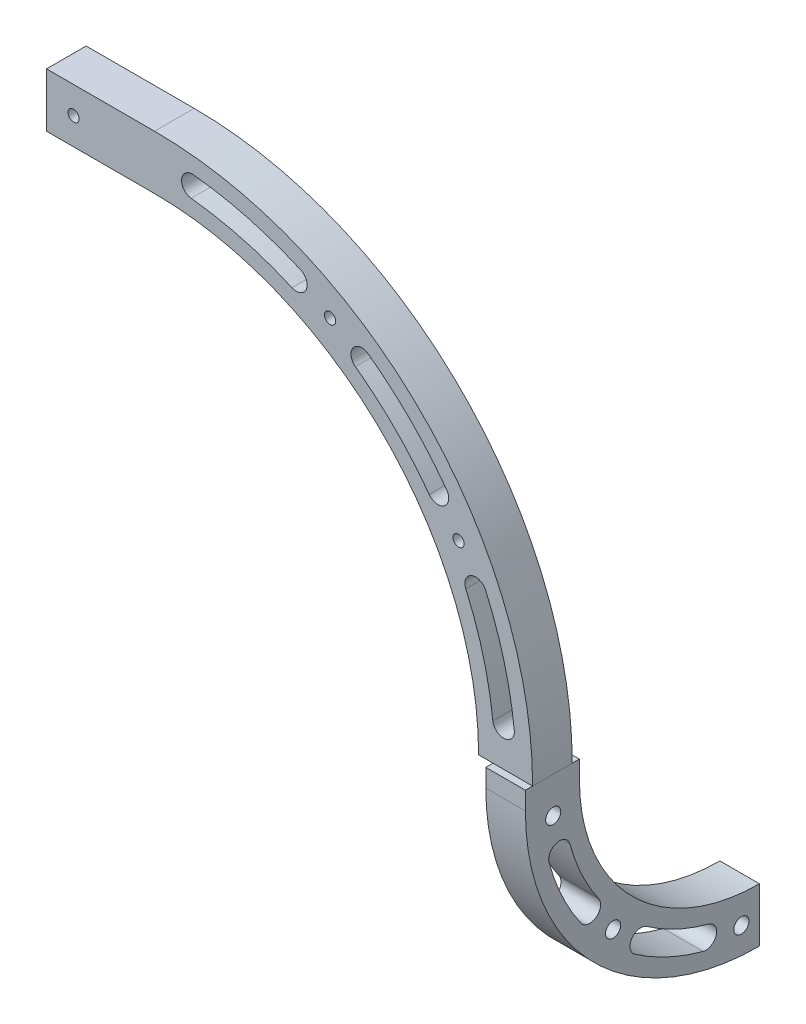
from build123d import *

# Parameters (mm, degrees)
EXTRUDE_1_DEPTH     = 15
SKETCH_2_W          = 15
SKETCH_2_H          = 15
EXTRUDE_2_DEPTH     = 5
EXTRUDE_3_DEPTH     = 15
SKETCH_4_R          = 1.55
CUT_EXTRUDE_1_DEPTH = 163.095650774
SKETCH_5_R          = 1.55
CUT_EXTRUDE_2_DEPTH = 157.68439616
CUT_EXTRUDE_START   = -2
CUT_EXTRUDE_4_DEPTH = 2
CUT_EXTRUDE_START_2 = -4
CUT_EXTRUDE_5_DEPTH = 4
CUT_EXTRUDE_6_DEPTH = 2
SKETCH_9_W          = 11
SKETCH_9_H          = 15
EXTRUDE_4_DEPTH     = 30
SKETCH_11_W         = 15
SKETCH_11_H         = 5
CUT_EXTRUDE_7_DEPTH = 4
SKETCH_12_R         = 2.1
CUT_EXTRUDE_8_DEPTH = 4.5
SKETCH_13_R         = 1.55
CUT_EXTRUDE_9_DEPTH = 162.304060705


with BuildPart() as part:
    # 草图1 → 凸台-拉伸1 (new body)
    with BuildSketch(Plane.XY):
        with BuildLine():
            Line((90, 0), (105, 0))
            ThreePointArc((105, 0), (74.246212025, 74.246212025), (0, 105))
            Line((0, 105), (0, 90))
            ThreePointArc((0, 90), (63.639610307, 63.639610307), (90, 0))
        make_face()
    extrude(amount=EXTRUDE_1_DEPTH)

    # 草图2 → 凸台-拉伸2 (add)
    with BuildSketch(Plane.XZ):
        with Locations((97.5, 7.5)):
            Rectangle(SKETCH_2_W, SKETCH_2_H)
    extrude(amount=EXTRUDE_2_DEPTH)

    # 草图3 → 凸台-拉伸3 (add)
    with BuildSketch(Plane(origin=(105, 0, 0), x_dir=(0, 0, -1), z_dir=(1, 0, 0))):
        with BuildLine():
            Line((50, -55), (50, -70))
            ThreePointArc((50, -70), (4.038059223, -50.961940777), (-15, -5))
            Line((-15, -5), (0, -5))
            ThreePointArc((0, -5), (14.644660941, -40.355339059), (50, -55))
        make_face()
    extrude(amount=-EXTRUDE_3_DEPTH)

    # 草图4 → 切除-拉伸1 (cut, through all)
    with BuildSketch(Plane.XY.offset(15)):
        with Locations((84.437476869, 48.75)):
            Circle(SKETCH_4_R)
        with Locations((48.75, 84.437476869)):
            Circle(SKETCH_4_R)
        with BuildLine():
            ThreePointArc((40.593936087, 91.936838933), (26.011314033, 97.075545542), (10.813039575, 99.916606103))
            ThreePointArc((10.813039575, 99.916606103), (7.507677018, 97.256798147), (10.167484974, 93.951435589))
            ThreePointArc((10.167484974, 93.951435589), (24.458399762, 91.279990584), (38.170417515, 86.448072429))
            ThreePointArc((38.170417515, 86.448072429), (42.126560053, 87.980696395), (40.593936087, 91.936838933))
        make_face()
        with BuildLine():
            ThreePointArc((81.123799357, 59.322670016), (71.064231509, 71.064231509), (59.322670016, 81.123799357))
            ThreePointArc((59.322670016, 81.123799357), (55.130238094, 80.473019377), (55.781018075, 76.280587456))
            ThreePointArc((55.781018075, 76.280587456), (66.821590822, 66.821590822), (76.280587456, 55.781018075))
            ThreePointArc((76.280587456, 55.781018075), (80.473019377, 55.130238094), (81.123799357, 59.322670016))
        make_face()
        with BuildLine():
            ThreePointArc((99.916606103, 10.813039575), (97.075545542, 26.011314033), (91.936838933, 40.593936087))
            ThreePointArc((91.936838933, 40.593936087), (87.980696395, 42.126560053), (86.448072429, 38.170417515))
            ThreePointArc((86.448072429, 38.170417515), (91.279990584, 24.458399762), (93.951435589, 10.167484974))
            ThreePointArc((93.951435589, 10.167484974), (97.256798147, 7.507677018), (99.916606103, 10.813039575))
        make_face()
    extrude(amount=-CUT_EXTRUDE_1_DEPTH, mode=Mode.SUBTRACT)

    # 草图5 → 切除-拉伸2 (cut, through all)
    with BuildSketch(Plane(origin=(105, 0, 0), x_dir=(0, 0, -1), z_dir=(1, 0, 0))):
        with Locations((44.969401847, -62.5)):
            Circle(SKETCH_5_R)
        with Locations((9.341360082, -45.658639918)):
            Circle(SKETCH_5_R)
        with Locations((-7.28119514, -10.011455208)):
            Circle(SKETCH_5_R)
        with BuildLine():
            ThreePointArc((-8.432245014, -20.681924073), (-4.831621116, -30.568404835), (0.427426106, -39.681550102))
            ThreePointArc((0.427426106, -39.681550102), (4.605316552, -40.419947976), (5.343714426, -36.24205753))
            ThreePointArc((5.343714426, -36.24205753), (0.606225607, -28.032695265), (-2.637311624, -19.126691933))
            ThreePointArc((-2.637311624, -19.126691933), (-6.312394389, -17.006841308), (-8.432245014, -20.681924073))
        make_face()
        with BuildLine():
            ThreePointArc((15.318449898, -54.572573894), (24.431595165, -59.831621116), (34.318075927, -63.432245014))
            ThreePointArc((34.318075927, -63.432245014), (37.993158692, -61.312394389), (35.873308067, -57.637311624))
            ThreePointArc((35.873308067, -57.637311624), (26.967304735, -54.393774393), (18.75794247, -49.656285574))
            ThreePointArc((18.75794247, -49.656285574), (14.580052024, -50.394683448), (15.318449898, -54.572573894))
        make_face()
    extrude(amount=-CUT_EXTRUDE_2_DEPTH, mode=Mode.SUBTRACT)

    # 草图7 → 切除-拉伸4 (cut)
    with BuildSketch(Plane.XY.offset(15).offset(CUT_EXTRUDE_START)):
        with BuildLine():
            Line((0, 105), (0, 90))
            ThreePointArc((0, 90), (63.639610307, 63.639610307), (90, 0))
            Line((90, 0), (105, 0))
            ThreePointArc((105, 0), (74.246212025, 74.246212025), (0, 105))
        make_face()
    extrude(amount=CUT_EXTRUDE_4_DEPTH, mode=Mode.SUBTRACT)

    # 草图8 → 切除-拉伸5 (cut)
    with BuildSketch(Plane.ZY.offset(-90).offset(CUT_EXTRUDE_START_2)):
        with BuildLine():
            Line((-50, -55), (-50, -70))
            ThreePointArc((-50, -70), (-4.038059223, -50.961940777), (15, -5))
            Line((15, -5), (0, -5))
            ThreePointArc((0, -5), (-14.644660941, -40.355339059), (-50, -55))
        make_face()
    extrude(amount=CUT_EXTRUDE_5_DEPTH, mode=Mode.SUBTRACT)

    # 草图10 → 切除-拉伸6 (cut)
    with BuildSketch(Plane.XY):
        with BuildLine():
            Line((0, 105), (0, 90))
            ThreePointArc((0, 90), (63.639610307, 63.639610307), (90, 0))
            Line((90, 0), (105, 0))
            ThreePointArc((105, 0), (74.246212025, 74.246212025), (0, 105))
        make_face()
    extrude(amount=CUT_EXTRUDE_6_DEPTH, mode=Mode.SUBTRACT)

    # 草图9 → 凸台-拉伸4 (add)
    with BuildSketch(Plane.ZY):
        with Locations((7.5, 97.5)):
            Rectangle(SKETCH_9_W, SKETCH_9_H)
    extrude(amount=EXTRUDE_4_DEPTH)

    # 草图11 → 切除-拉伸7 (cut)
    with BuildSketch(Plane.ZY.offset(-90)):
        with Locations((7.5, -2.5)):
            Rectangle(SKETCH_11_W, SKETCH_11_H)
    extrude(amount=-CUT_EXTRUDE_7_DEPTH, mode=Mode.SUBTRACT)

    # 草图12 → 切除-拉伸8 (cut)
    with BuildSketch(Plane(origin=(105, 0, 0), x_dir=(0, 0, -1), z_dir=(1, 0, 0))):
        with Locations((-7.28119514, -10.011455208)):
            Circle(SKETCH_12_R)
        with Locations((9.341360082, -45.658639918)):
            Circle(SKETCH_12_R)
        with Locations((44.969401847, -62.5)):
            Circle(SKETCH_12_R)
    extrude(amount=-CUT_EXTRUDE_8_DEPTH, mode=Mode.SUBTRACT)

    # 草图13 → 切除-拉伸9 (cut, through all)
    with BuildSketch(Plane.XY.offset(13)):
        with Locations((-22.5, 97.5)):
            Circle(SKETCH_13_R)
    extrude(amount=-CUT_EXTRUDE_9_DEPTH, mode=Mode.SUBTRACT)


solid = part.part
